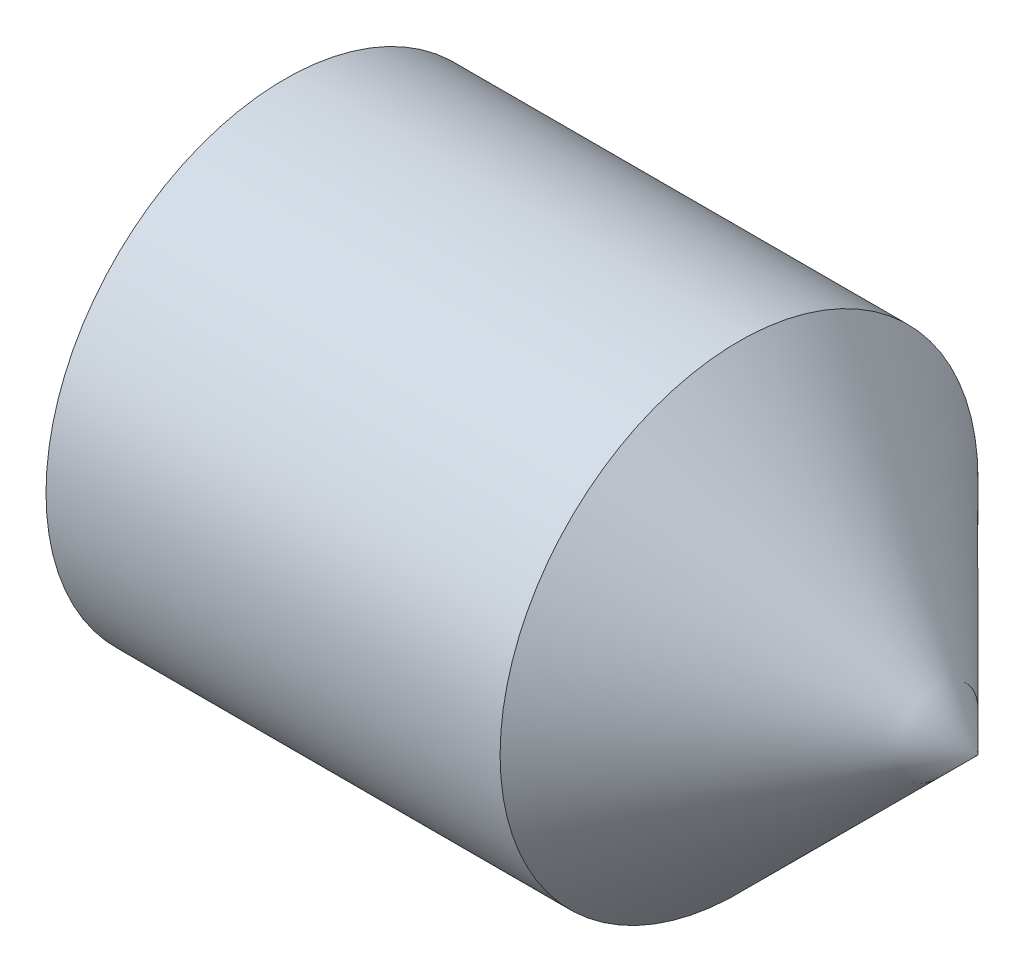
from build123d import *

# Parameters (mm, degrees)
HEX_2_DEPTH = 5


with BuildPart() as part:
    # BodySke → BaseBody (revolve)
    with BuildSketch(Plane.XY, mode=Mode.PRIVATE) as basebody_sk:
        Polygon((0, 0), (0, 3.3095), (0.398660361, 4), (8, 4), (12, 0), align=None)
    revolve(basebody_sk.sketch.rotate(Axis((-12.7, 0, 0), (1, 0, 0)), 90), axis=Axis((-12.7, 0, 0), (1, 0, 0)))

    # Sketch2 → Hex 2 (cut)
    with BuildSketch(Plane.ZY):
        Polygon((1.154700538, 2), (-1.154700538, 2), (-2.309401077, 0), (-1.154700538, -2), (1.154700538, -2), (2.309401077, 0), align=None)
    extrude(amount=-HEX_2_DEPTH, mode=Mode.SUBTRACT)


solid = part.part
